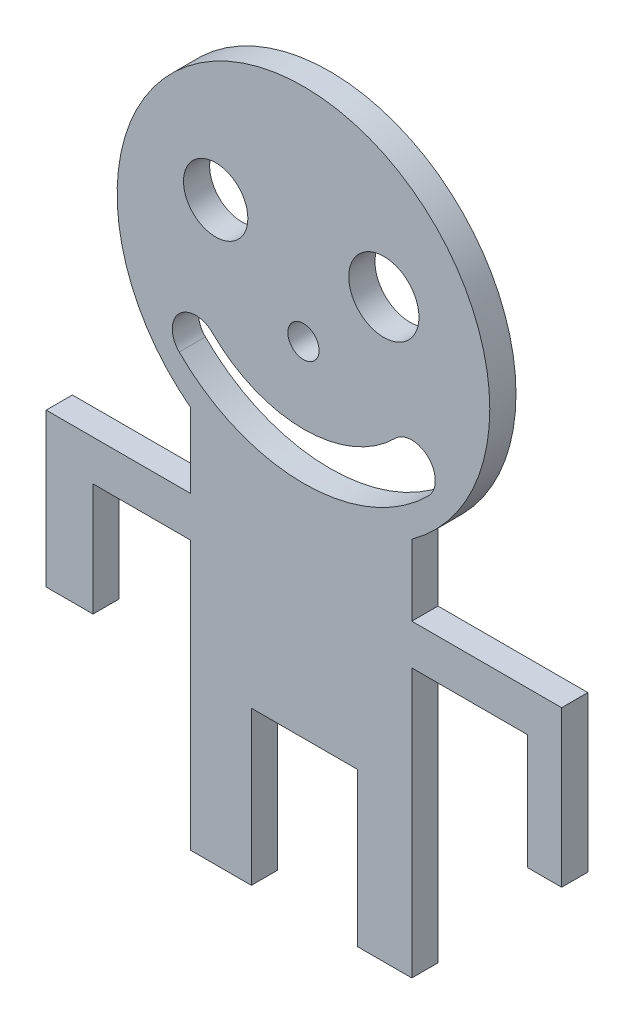
from build123d import *

# Parameters (mm, degrees)
SKETCH1_R           = 12.288018633
SKETCH1_R_2         = 13.402342443
SKETCH1_R_3         = 5.966655134
BOSS_EXTRUDE1_DEPTH = 10


with BuildPart() as part:
    # Sketch1 → Boss-Extrude1 (new body)
    with BuildSketch(Plane.XY):
        with BuildLine():
            Line((-43.16670826, -100.459006624), (-43.16670826, -144.386357681))
            Line((-43.16670826, -144.386357681), (-43.16670826, -202.977586365))
            Line((-43.16670826, -202.977586365), (-19.89608029, -202.977586365))
            Line((-19.89608029, -202.977586365), (-19.89608029, -144.386357681))
            Line((-19.89608029, -144.386357681), (20.715262102, -144.386357681))
            Line((20.715262102, -144.386357681), (20.715262102, -202.977586365))
            Line((20.715262102, -202.977586365), (41.349988273, -202.977586365))
            Line((41.349988273, -202.977586365), (41.349988273, -144.386357681))
            Line((41.349988273, -144.386357681), (41.349988273, -100.459006624))
            Line((41.349988273, -100.459006624), (85.500022586, -100.459006624))
            Line((85.500022586, -100.459006624), (85.500022586, -144.386357681))
            Line((85.500022586, -144.386357681), (98.553668355, -144.386357681))
            Line((98.553668355, -144.386357681), (98.553668355, -100.459006624))
            Line((98.553668355, -100.459006624), (98.553668355, -85.011306082))
            Line((98.553668355, -85.011306082), (41.349988273, -85.011306082))
            Line((41.349988273, -85.011306082), (41.349988273, -57.873752711))
            ThreePointArc((41.349988273, -57.873752711), (1.129346742, 71.119036544), (-43.16670826, -56.531655566))
            Line((-43.16670826, -56.531655566), (-43.16670826, -85.011306082))
            Line((-43.16670826, -85.011306082), (-98.217954904, -85.011306082))
            Line((-98.217954904, -85.011306082), (-98.217954904, -100.459006624))
            Line((-98.217954904, -100.459006624), (-98.217954904, -143.510977861))
            Line((-98.217954904, -143.510977861), (-80.329625517, -143.510977861))
            Line((-80.329625517, -143.510977861), (-80.329625517, -100.459006624))
            Line((-80.329625517, -100.459006624), (-43.16670826, -100.459006624))
        make_face()
        with Locations((-33.517420804, 16.851364033)):
            Circle(SKETCH1_R, mode=Mode.SUBTRACT)
        with Locations((30.688490145, 16.851364033)):
            Circle(SKETCH1_R_2, mode=Mode.SUBTRACT)
        with Locations((0, -13.237752907)):
            Circle(SKETCH1_R_3, mode=Mode.SUBTRACT)
        with BuildLine():
            ThreePointArc((-47.4424626, -40.430436817), (0.125528844, -60.133744008), (47.693520288, -40.430436817))
            ThreePointArc((47.693520288, -40.430436817), (47.693520288, -27.743372786), (35.006456257, -27.743372786))
            ThreePointArc((35.006456257, -27.743372786), (0.125528844, -42.191525989), (-34.755398569, -27.743372786))
            ThreePointArc((-34.755398569, -27.743372786), (-47.4424626, -27.743372786), (-47.4424626, -40.430436817))
        make_face(mode=Mode.SUBTRACT)
    extrude(amount=BOSS_EXTRUDE1_DEPTH)


solid = part.part
